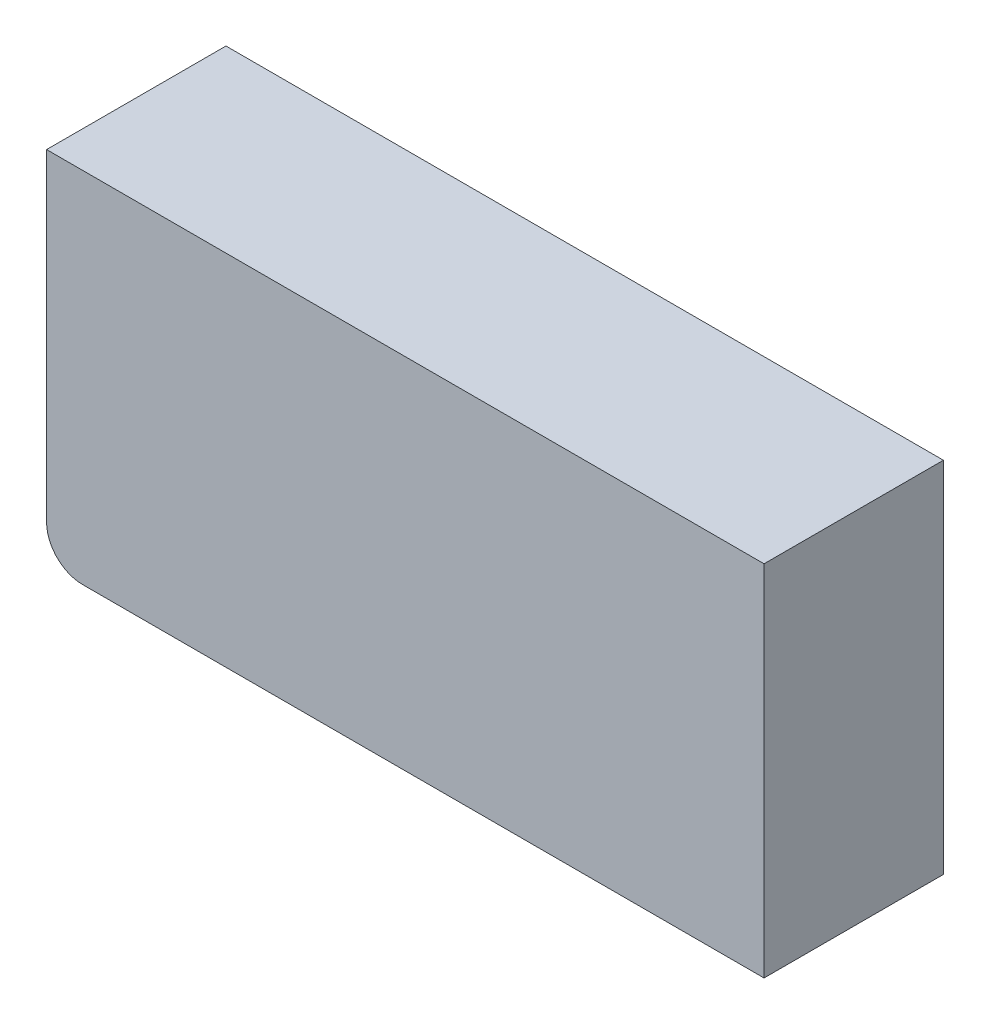
from build123d import *

# Parameters (mm, degrees)
SKETCH1_W           = 40
SKETCH1_H           = 20
BOSS_EXTRUDE1_DEPTH = 10
FILLET1_R           = 2


with BuildPart() as part:
    # Sketch1 → Boss-Extrude1 (new body)
    with BuildSketch(Plane.XY):
        with Locations((20, 10)):
            Rectangle(SKETCH1_W, SKETCH1_H)
    extrude(amount=BOSS_EXTRUDE1_DEPTH)

    # Fillet1
    fillet1_edges = [part.edges().sort_by_distance(p)[0] for p in [
        (0, 0, 5),
    ]]
    fillet(fillet1_edges, radius=FILLET1_R)


solid = part.part
